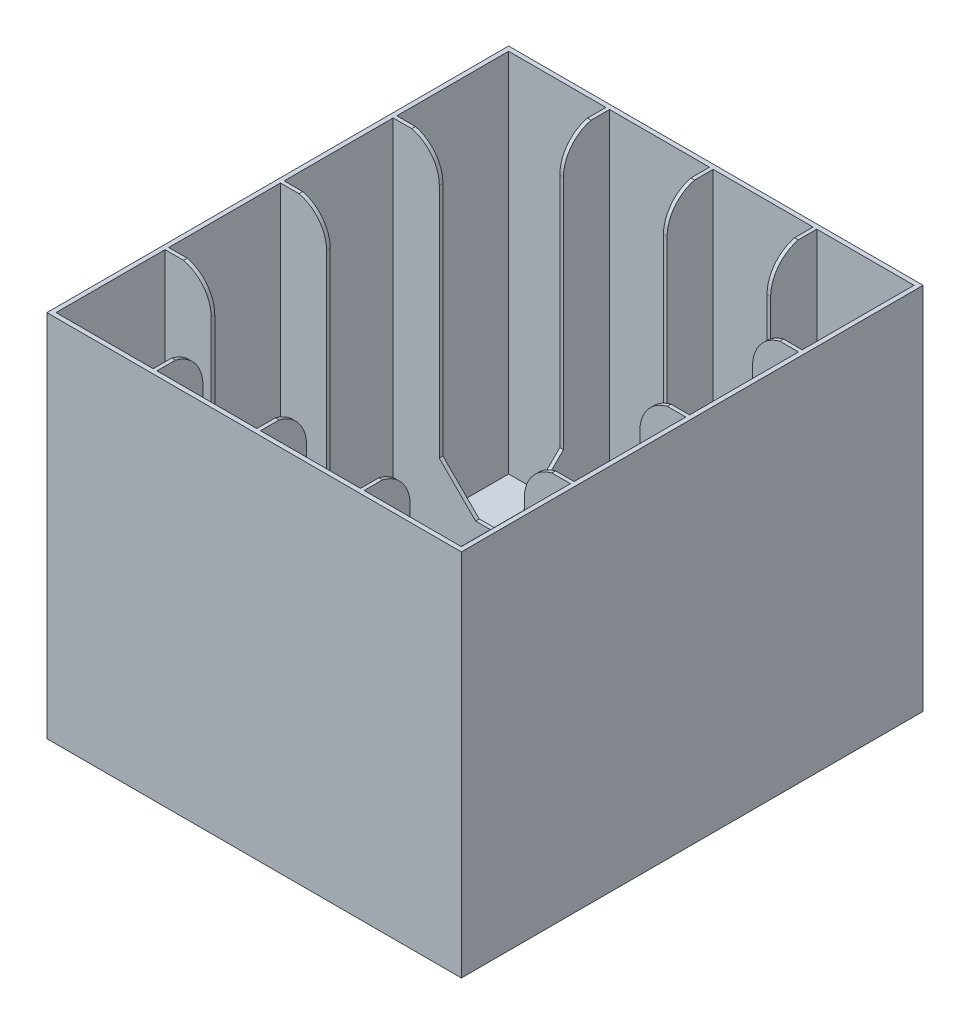
from build123d import *

# Parameters (mm, degrees)
SKETCH2_W            = 228
SKETCH2_H            = 254
BOSS_EXTRUDE1_DEPTH  = 1.6
SKETCH2_6_W          = 228
SKETCH2_6_H          = 254
BOSS_EXTRUDE2_DEPTH  = 202
SKETCH2_7_W          = 2
SKETCH2_7_H          = 60
BOSS_EXTRUDE6_DEPTH  = 202
SKETCH2_8_W          = 54.5
SKETCH2_8_H          = 2
BOSS_EXTRUDE7_DEPTH  = 202
SKETCH2_9_W          = 110.5
SKETCH2_9_H          = 2
BOSS_EXTRUDE8_DEPTH  = 202
SKETCH2_10_W         = 2
SKETCH2_10_H         = 61.5
BOSS_EXTRUDE12_DEPTH = 202
SKETCH2_11_W         = 2
SKETCH2_11_H         = 123.5
BOSS_EXTRUDE13_DEPTH = 202
SKETCH2_12_W         = 110.5
SKETCH2_12_H         = 2
BOSS_EXTRUDE14_DEPTH = 202
SKETCH2_13_W         = 57
SKETCH2_13_H         = 2
BOSS_EXTRUDE19_DEPTH = 202
SKETCH2_14_W         = 2
SKETCH2_14_H         = 63.5
BOSS_EXTRUDE25_DEPTH = 202
SKETCH2_17_W         = 55
SKETCH2_17_H         = 2
SKETCH2_17_W_2       = 2
SKETCH2_17_H_2       = 60
BOSS_EXTRUDE26_DEPTH = 202
SKETCH2_18_W         = 2
SKETCH2_18_H         = 123.5
BOSS_EXTRUDE27_DEPTH = 202
SKETCH2_21_W         = 54.5
SKETCH2_21_H         = 2
BOSS_EXTRUDE36_DEPTH = 202
SKETCH2_23_W         = 56
SKETCH2_23_H         = 2
BOSS_EXTRUDE40_DEPTH = 202
SKETCH2_24_W         = 53.5
SKETCH2_24_H         = 2
BOSS_EXTRUDE41_DEPTH = 202
SKETCH3_W            = 172.305308293
SKETCH3_H            = 198.305308293
CUT_EXTRUDE1_DEPTH   = 170
CHAMFER1_SIZE        = 20
FILLET1_R            = 20
SKETCH4_W            = 228
SKETCH4_H            = 254
CUT_EXTRUDE2_DEPTH   = 0.6


with BuildPart() as part:
    # Sketch2 → Boss-Extrude1 (new body)
    with BuildSketch(Plane(origin=(0, 0, 0), x_dir=(1, 0, 0), z_dir=(0, 1, 0))):
        with Locations((-506.55062157, 281.20079547)):
            Rectangle(SKETCH2_W, SKETCH2_H)
    extrude(amount=-BOSS_EXTRUDE1_DEPTH)

    # Sketch2<6> → Boss-Extrude2 (add)
    with BuildSketch(Plane(origin=(0, 0, 0), x_dir=(1, 0, 0), z_dir=(0, 1, 0))):
        with Locations((-506.55062157, 281.20079547)):
            Rectangle(SKETCH2_6_W, SKETCH2_6_H)
        Polygon((-618.05062157, 405.70079547), (-395.05062157, 405.70079547), (-395.05062157, 282.20079547), (-394.05062157, 282.20079547), (-394.05062157, 280.20079547), (-395.05062157, 280.20079547), (-395.05062157, 156.70079547), (-618.05062157, 156.70079547), align=None, mode=Mode.SUBTRACT)
    extrude(amount=BOSS_EXTRUDE2_DEPTH)

    # Sketch2<7> → Boss-Extrude6 (add)
    with BuildSketch(Plane(origin=(0, 0, 0), x_dir=(1, 0, 0), z_dir=(0, 1, 0))):
        with Locations((-449.55062157, 186.70079547)):
            Rectangle(SKETCH2_7_W, SKETCH2_7_H)
    extrude(amount=BOSS_EXTRUDE6_DEPTH)

    # Sketch2<8> → Boss-Extrude7 (add)
    with BuildSketch(Plane(origin=(0, 0, 0), x_dir=(1, 0, 0), z_dir=(0, 1, 0))):
        with Locations((-421.30062157, 281.20079547)):
            Rectangle(SKETCH2_8_W, SKETCH2_8_H)
    extrude(amount=BOSS_EXTRUDE7_DEPTH)

    # Sketch2<9> → Boss-Extrude8 (add)
    with BuildSketch(Plane(origin=(0, 0, 0), x_dir=(1, 0, 0), z_dir=(0, 1, 0))):
        with Locations((-450.30062157, 343.20079547)):
            Rectangle(SKETCH2_9_W, SKETCH2_9_H)
    extrude(amount=BOSS_EXTRUDE8_DEPTH)

    # Sketch2<10> → Boss-Extrude12 (add)
    with BuildSketch(Plane(origin=(0, 0, 0), x_dir=(1, 0, 0), z_dir=(0, 1, 0))):
        with Locations((-449.55062157, 374.95079547)):
            Rectangle(SKETCH2_10_W, SKETCH2_10_H)
    extrude(amount=BOSS_EXTRUDE12_DEPTH)

    # Sketch2<11> → Boss-Extrude13 (add)
    with BuildSketch(Plane(origin=(0, 0, 0), x_dir=(1, 0, 0), z_dir=(0, 1, 0))):
        with Locations((-449.55062157, 280.45079547)):
            Rectangle(SKETCH2_11_W, SKETCH2_11_H)
    extrude(amount=BOSS_EXTRUDE13_DEPTH)

    # Sketch2<12> → Boss-Extrude14 (add)
    with BuildSketch(Plane(origin=(0, 0, 0), x_dir=(1, 0, 0), z_dir=(0, 1, 0))):
        with Locations((-450.30062157, 217.70079547)):
            Rectangle(SKETCH2_12_W, SKETCH2_12_H)
    extrude(amount=BOSS_EXTRUDE14_DEPTH)

    # Sketch2<13> → Boss-Extrude19 (add)
    with BuildSketch(Plane(origin=(0, 0, 0), x_dir=(1, 0, 0), z_dir=(0, 1, 0))):
        with Locations((-479.05062157, 281.20079547)):
            Rectangle(SKETCH2_13_W, SKETCH2_13_H)
    extrude(amount=BOSS_EXTRUDE19_DEPTH)

    # Sketch2<14> → Boss-Extrude25 (add)
    with BuildSketch(Plane(origin=(0, 0, 0), x_dir=(1, 0, 0), z_dir=(0, 1, 0))):
        with Locations((-506.55062157, 248.45079547)):
            Rectangle(SKETCH2_14_W, SKETCH2_14_H)
    extrude(amount=BOSS_EXTRUDE25_DEPTH)

    # Sketch2<17> → Boss-Extrude26 (add)
    with BuildSketch(Plane(origin=(0, 0, 0), x_dir=(1, 0, 0), z_dir=(0, 1, 0))):
        with Locations((-535.05062157, 217.70079547)):
            Rectangle(SKETCH2_17_W, SKETCH2_17_H)
        with Locations((-506.55062157, 186.70079547)):
            Rectangle(SKETCH2_17_W_2, SKETCH2_17_H_2)
    extrude(amount=BOSS_EXTRUDE26_DEPTH)

    # Sketch2<18> → Boss-Extrude27 (add)
    with BuildSketch(Plane(origin=(0, 0, 0), x_dir=(1, 0, 0), z_dir=(0, 1, 0))):
        with Locations((-563.55062157, 218.45079547)):
            Rectangle(SKETCH2_18_W, SKETCH2_18_H)
    extrude(amount=BOSS_EXTRUDE27_DEPTH)

    # Sketch2<21> → Boss-Extrude36 (add)
    with BuildSketch(Plane(origin=(0, 0, 0), x_dir=(1, 0, 0), z_dir=(0, 1, 0))):
        with Locations((-590.80062157, 281.20079547)):
            Rectangle(SKETCH2_21_W, SKETCH2_21_H)
    extrude(amount=BOSS_EXTRUDE36_DEPTH)

    # Sketch2<23> → Boss-Extrude40 (add)
    with BuildSketch(Plane(origin=(0, 0, 0), x_dir=(1, 0, 0), z_dir=(0, 1, 0))):
        Polygon((-507.55062157, 406.70079547), (-507.55062157, 344.20079547), (-562.55062157, 344.20079547), (-562.55062157, 342.20079547), (-507.55062157, 342.20079547), (-507.55062157, 282.20079547), (-505.55062157, 282.20079547), (-505.55062157, 406.70079547), align=None)
        with Locations((-535.55062157, 281.20079547)):
            Rectangle(SKETCH2_23_W, SKETCH2_23_H)
    extrude(amount=BOSS_EXTRUDE40_DEPTH)

    # Sketch2<24> → Boss-Extrude41 (add)
    with BuildSketch(Plane(origin=(0, 0, 0), x_dir=(1, 0, 0), z_dir=(0, 1, 0))):
        Polygon((-564.55062157, 405.70079547), (-564.55062157, 344.20079547), (-618.05062157, 344.20079547), (-618.05062157, 342.20079547), (-564.55062157, 342.20079547), (-564.55062157, 282.20079547), (-562.55062157, 282.20079547), (-562.55062157, 405.70079547), align=None)
        with Locations((-591.30062157, 217.70079547)):
            Rectangle(SKETCH2_24_W, SKETCH2_24_H)
    extrude(amount=BOSS_EXTRUDE41_DEPTH)

    # Sketch3 → Cut-Extrude1 (cut)
    with BuildSketch(Plane(origin=(0, 202, 0), x_dir=(1, 0, 0), z_dir=(0, 1, 0))):
        with Locations((-506.550621569, 281.20079547)):
            Rectangle(SKETCH3_W, SKETCH3_H)
    extrude(amount=-CUT_EXTRUDE1_DEPTH, mode=Mode.SUBTRACT)

    # Chamfer1
    chamfer1_edges = [part.edges().sort_by_distance(p)[0] for p in [
        (-563.55062157, 32, -182.048141324),
        (-506.55062157, 32, -182.048141324),
        (-449.55062157, 32, -182.048141324),
        (-420.397967423, 32, -217.70079547),
        (-420.397967423, 32, -281.20079547),
        (-420.397967423, 32, -343.20079547),
        (-592.703275716, 32, -217.70079547),
        (-592.703275716, 32, -281.20079547),
        (-449.55062157, 32, -380.353449617),
        (-506.55062157, 32, -380.353449617),
        (-563.55062157, 32, -380.353449617),
        (-592.703275716, 32, -343.20079547),
    ]]
    chamfer(chamfer1_edges, length=CHAMFER1_SIZE)

    # Fillet1
    fillet1_edges = [part.edges().sort_by_distance(p)[0] for p in [
        (-420.397967423, 202, -217.70079547),
        (-420.397967423, 202, -281.20079547),
        (-420.397967423, 202, -343.20079547),
        (-449.55062157, 202, -380.353449617),
        (-506.55062157, 202, -380.353449617),
        (-563.55062157, 202, -380.353449617),
        (-592.703275716, 202, -343.20079547),
        (-592.703275716, 202, -281.20079547),
        (-592.703275716, 202, -217.70079547),
        (-563.55062157, 202, -182.048141324),
        (-506.55062157, 202, -182.048141324),
        (-449.55062157, 202, -182.048141324),
    ]]
    fillet(fillet1_edges, radius=FILLET1_R)

    # Sketch4 → Cut-Extrude2 (cut)
    with BuildSketch(Plane(origin=(0, 202, 0), x_dir=(1, 0, 0), z_dir=(0, 1, 0))):
        with Locations((-506.55062157, 281.20079547)):
            Rectangle(SKETCH4_W, SKETCH4_H)
    extrude(amount=-CUT_EXTRUDE2_DEPTH, mode=Mode.SUBTRACT)


solid = part.part
